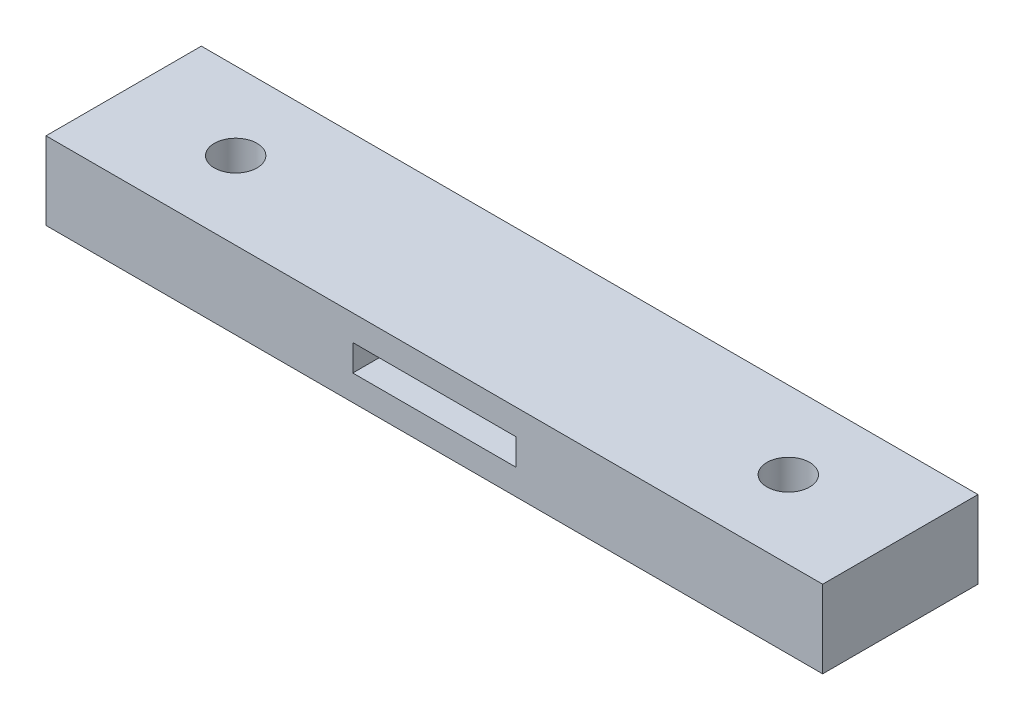
from build123d import *

# Parameters (mm, degrees)
SKETCH2_W           = 127
SKETCH2_H           = 12.7
SKETCH2_W_2         = 26.67
SKETCH2_H_2         = 4.318
BOSS_EXTRUDE1_DEPTH = 25.4
SKETCH3_R           = 3.4925
CUT_EXTRUDE1_DEPTH  = 70.560764803


with BuildPart() as part:
    # Sketch2 → Boss-Extrude1 (new body)
    with BuildSketch(Plane.XY):
        Rectangle(SKETCH2_W, SKETCH2_H)
        Rectangle(SKETCH2_W_2, SKETCH2_H_2, mode=Mode.SUBTRACT)
    extrude(amount=BOSS_EXTRUDE1_DEPTH)

    # Sketch3 → Cut-Extrude1 (cut, through all)
    with BuildSketch(Plane(origin=(0, 6.35, 0), x_dir=(1, 0, 0), z_dir=(0, 1, 0))):
        with Locations(Location((45.184541112, -12.7, 0), (0, 0, 270))):
            Circle(SKETCH3_R)
        with Locations(Location((-45.184541112, -12.7, 0), (0, 0, 270))):
            Circle(SKETCH3_R)
    extrude(amount=-CUT_EXTRUDE1_DEPTH, mode=Mode.SUBTRACT)


solid = part.part
